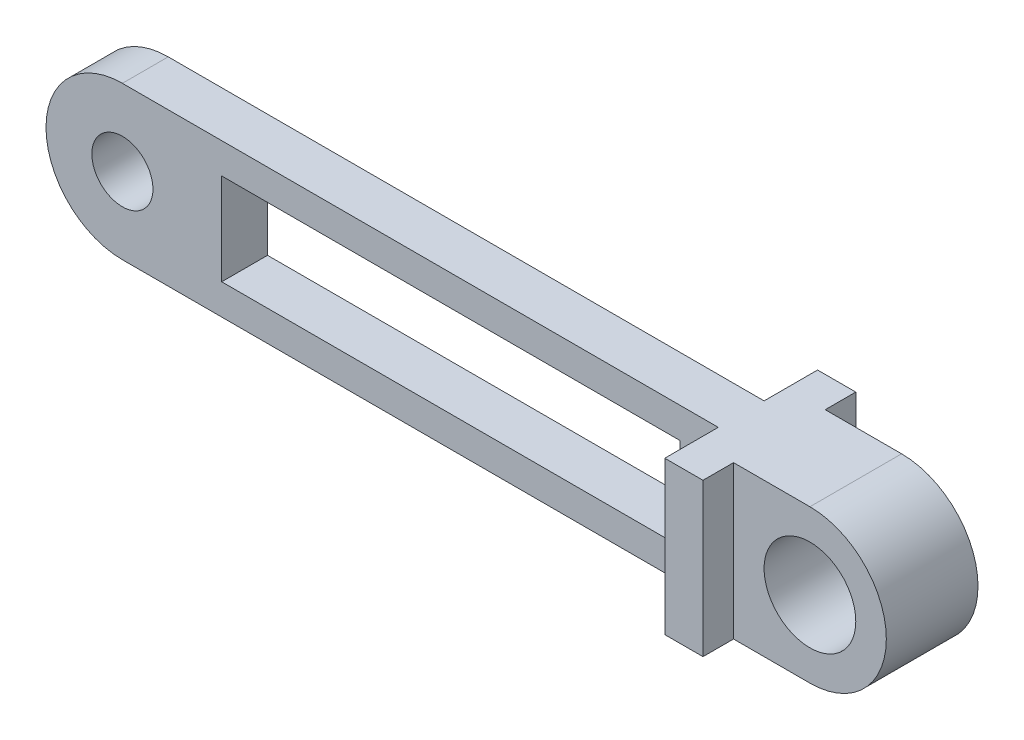
from build123d import *

# Parameters (mm, degrees)
SKETCH_1_R      = 4
SKETCH_1_W      = 60
SKETCH_1_H      = 12
EXTRUDE_1_DEPTH = 3
EXTRUDE_START   = 35
SKETCH_2_W      = 20
SKETCH_2_H      = 20
EXTRUDE_2_DEPTH = 5
SKETCH_3_R      = 6
EXTRUDE_3_DEPTH = 6


with BuildPart() as part:
    # 草图1 → 凸台-拉伸1 (new, symmetric)
    with BuildSketch(Plane.XY):
        with BuildLine():
            Line((-35, 10), (35, 10))
            Line((35, 10), (35, -10))
            Line((35, -10), (-35, -10))
            Line((-35, -10), (-43, -10))
            ThreePointArc((-43, -10), (-53, 0), (-43, 10))
            Line((-43, 10), (-35, 10))
        make_face()
        with Locations((-43, 0)):
            Circle(SKETCH_1_R, mode=Mode.SUBTRACT)
        Rectangle(SKETCH_1_W, SKETCH_1_H, mode=Mode.SUBTRACT)
    extrude(amount=EXTRUDE_1_DEPTH, both=True)

    # 草图2 → 凸台-拉伸2 (add)
    with BuildSketch(Plane(origin=(0, 0, 0), x_dir=(0, 0, -1), z_dir=(1, 0, 0)).offset(EXTRUDE_START)):
        Rectangle(SKETCH_2_W, SKETCH_2_H)
    extrude(amount=EXTRUDE_2_DEPTH)

    # 草图3 → 凸台-拉伸3 (add, symmetric)
    with BuildSketch(Plane.XY):
        with BuildLine():
            Line((40, 10), (50, 10))
            ThreePointArc((50, 10), (60, 0), (50, -10))
            Line((50, -10), (40, -10))
            Line((40, -10), (40, 10))
        make_face()
        with Locations((50, 0)):
            Circle(SKETCH_3_R, mode=Mode.SUBTRACT)
    extrude(amount=EXTRUDE_3_DEPTH, both=True)


solid = part.part
